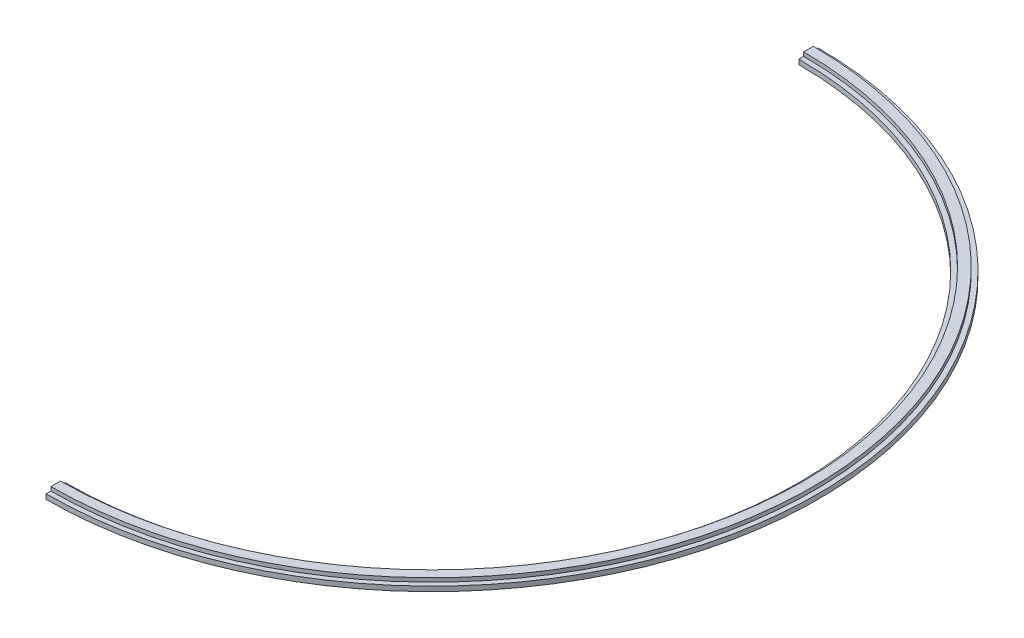
from build123d import *

# Parameters (mm, degrees)
BOSS_EXTRUDE1_DEPTH = 50
BOSS_EXTRUDE2_DEPTH = 40


with BuildPart() as part:
    # Sketch1 → Boss-Extrude1 (new body)
    with BuildSketch(Plane(origin=(0, 0, 0), x_dir=(1, 0, 0), z_dir=(0, 1, 0))):
        with BuildLine():
            ThreePointArc((4000, 0), (2828.427124746, 2828.427124746), (0, 4000))
            Line((0, 4000), (0, 3800))
            ThreePointArc((0, 3800), (2687.005768509, 2687.005768509), (3800, 0))
            ThreePointArc((3800, 0), (2687.005768509, -2687.005768509), (0, -3800))
            Line((0, -3800), (0, -4000))
            ThreePointArc((0, -4000), (2828.427124746, -2828.427124746), (4000, 0))
        make_face()
    extrude(amount=BOSS_EXTRUDE1_DEPTH)

    # Sketch2 → Boss-Extrude2 (add)
    with BuildSketch(Plane(origin=(0, 50, 0), x_dir=(1, 0, 0), z_dir=(0, 1, 0))):
        with BuildLine():
            ThreePointArc((3950, 0), (2793.071785687, 2793.071785687), (0, 3950))
            Line((0, 3950), (0, 3850))
            ThreePointArc((0, 3850), (2722.361107568, 2722.361107568), (3850, 0))
            ThreePointArc((3850, 0), (2722.361107568, -2722.361107568), (0, -3850))
            Line((0, -3850), (0, -3950))
            ThreePointArc((0, -3950), (2793.071785687, -2793.071785687), (3950, 0))
        make_face()
    extrude(amount=BOSS_EXTRUDE2_DEPTH)


solid = part.part
